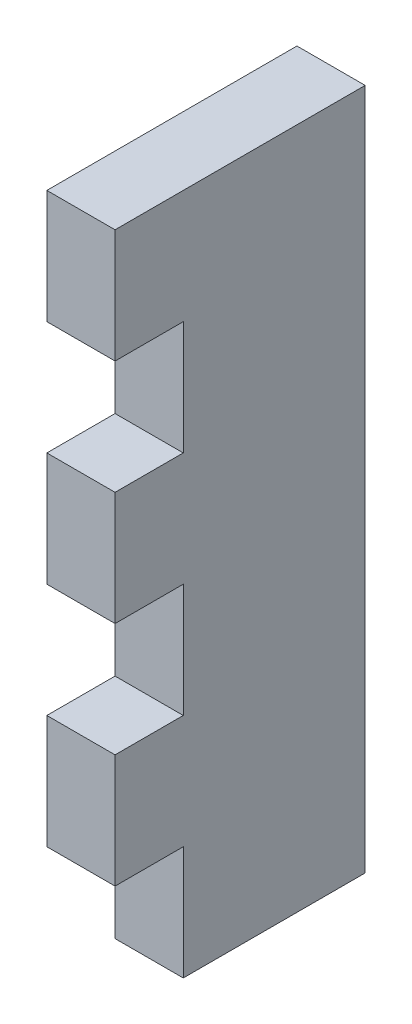
from build123d import *

# Parameters (mm, degrees)
SKETCH1_W           = 11
SKETCH1_H           = 30
BOSS_EXTRUDE1_DEPTH = 3
SKETCH2_W           = 3
SKETCH2_H           = 5
CUT_EXTRUDE1_DEPTH  = 3


with BuildPart() as part:
    # Sketch1 → Boss-Extrude1 (new body)
    with BuildSketch(Plane(origin=(0, 0, 0), x_dir=(0, 0, -1), z_dir=(1, 0, 0))):
        Rectangle(SKETCH1_W, SKETCH1_H)
    extrude(amount=BOSS_EXTRUDE1_DEPTH)

    # Sketch2 → Cut-Extrude1 (cut)
    with BuildSketch(Plane(origin=(3, 0, 0), x_dir=(0, 0, -1), z_dir=(1, 0, 0))):
        with Locations((-4, -12.5)):
            Rectangle(SKETCH2_W, SKETCH2_H)
        with Locations((-4, 7.5)):
            Rectangle(SKETCH2_W, SKETCH2_H)
        with Locations((-4, -2.5)):
            Rectangle(SKETCH2_W, SKETCH2_H)
    extrude(amount=-CUT_EXTRUDE1_DEPTH, mode=Mode.SUBTRACT)


solid = part.part
